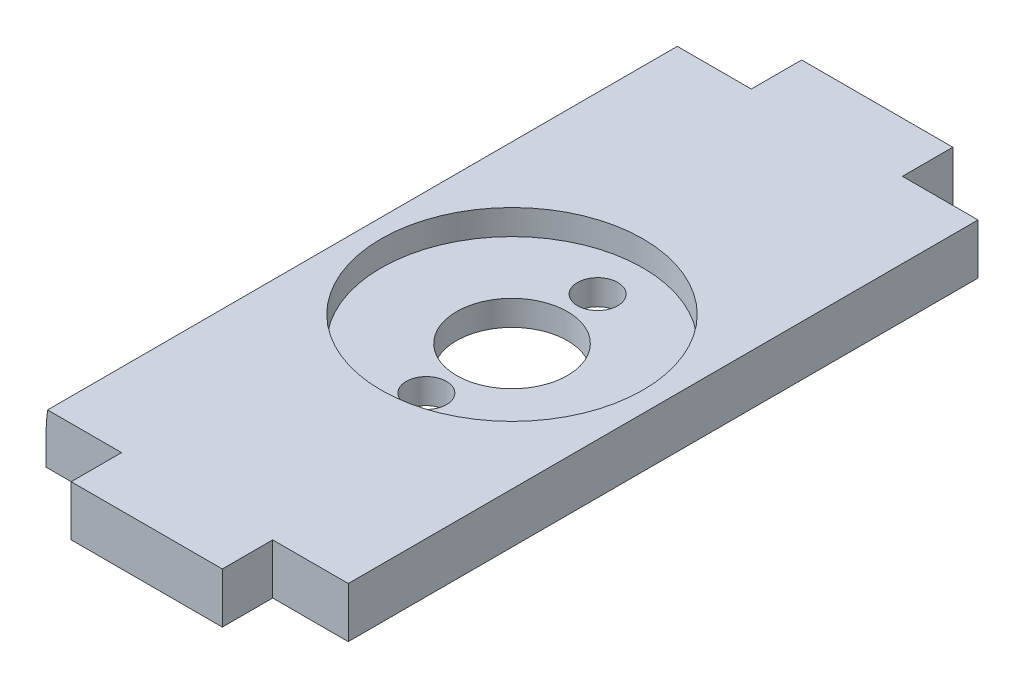
from build123d import *

# Parameters (mm, degrees)
SKETCH1_R           = 5.5
SKETCH1_R_2         = 2
BOSS_EXTRUDE1_DEPTH = 5
SKETCH2_R           = 13
CUT_EXTRUDE1_DEPTH  = 2.5
CUT_EXTRUDE2_DEPTH  = 62.5


with BuildPart() as part:
    # Sketch1 → Boss-Extrude1 (new body)
    with BuildSketch(Plane(origin=(0, 0, 0), x_dir=(1, 0, 0), z_dir=(0, 1, 0))):
        Polygon((7.5, -31.25), (15, -31.25), (15, 31.25), (7.5, 31.25), (7.5, 36.25), (-7.5, 36.25), (-7.5, 31.25), (-15, 31.25), (-15, -31.25), (-7.5, -31.25), (-7.5, -36.25), (7.5, -36.25), align=None)
        with Locations(Location((0, 0, 0), (0, 0, 270))):
            Circle(SKETCH1_R, mode=Mode.SUBTRACT)
        with Locations(Location((0, 8.5, 0), (0, 0, 270))):
            Circle(SKETCH1_R_2, mode=Mode.SUBTRACT)
        with Locations(Location((0, -8.5, 0), (0, 0, 270))):
            Circle(SKETCH1_R_2, mode=Mode.SUBTRACT)
    extrude(amount=BOSS_EXTRUDE1_DEPTH)

    # Sketch2 → Cut-Extrude1 (cut)
    with BuildSketch(Plane(origin=(0, 5, 0), x_dir=(1, 0, 0), z_dir=(0, 1, 0))):
        with Locations(Location((0, 0, 0), (0, 0, 270))):
            Circle(SKETCH2_R)
    extrude(amount=-CUT_EXTRUDE1_DEPTH, mode=Mode.SUBTRACT)

    # Sketch3 → Cut-Extrude2 (cut)
    with BuildSketch(Plane.XY.offset(31.25)):
        with BuildLine():
            Line((-15, 5), (-15, 2.5))
            ThreePointArc((-15, 2.5), (-14.960745185, 3.752458251), (-14.843134833, 5))
            Line((-14.843134833, 5), (-15, 5))
        make_face()
    extrude(amount=-CUT_EXTRUDE2_DEPTH, mode=Mode.SUBTRACT)


solid = part.part
